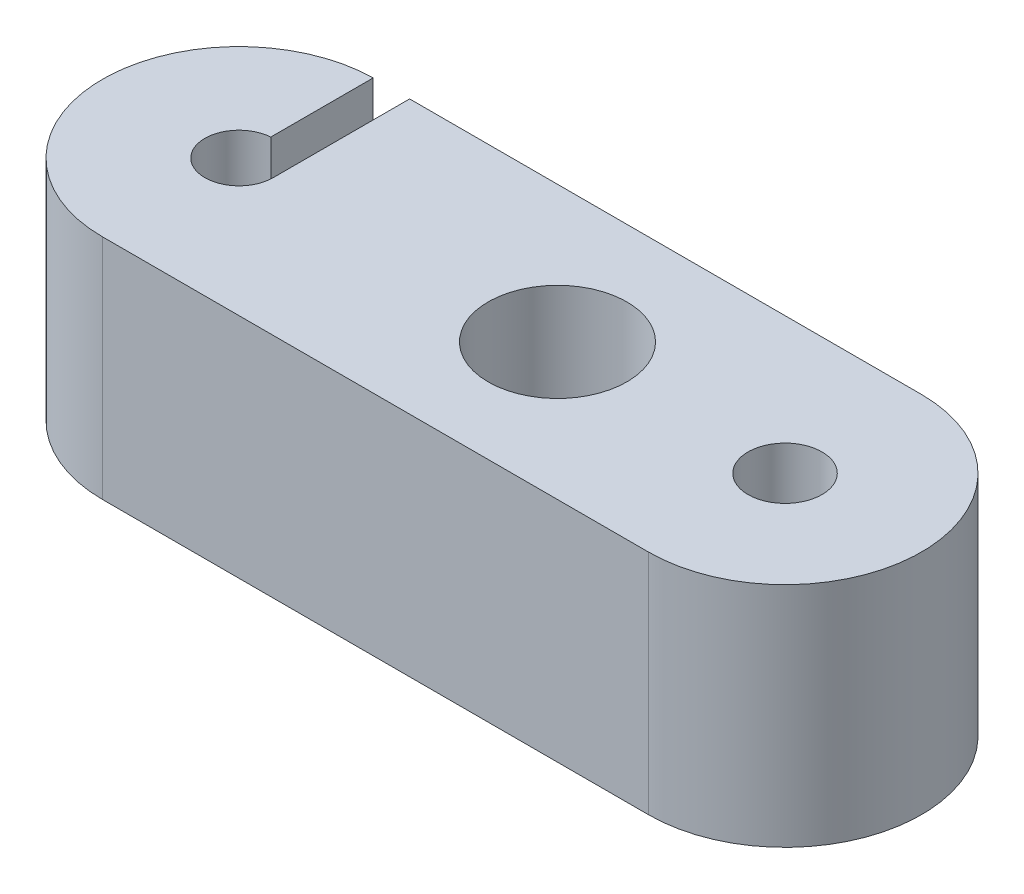
from build123d import *

# Parameters (mm, degrees)
SKETCH1_R           = 0.762
SKETCH1_R_2         = 0.4064
SKETCH1_R_3         = 0.375
BOSS_EXTRUDE1_DEPTH = 2.5
SKETCH2_W           = 0.4
SKETCH2_H           = 2.5
CUT_EXTRUDE1_DEPTH  = 6.361902647


with BuildPart() as part:
    # Sketch1 → Boss-Extrude1 (new body)
    with BuildSketch(Plane(origin=(0, 0, 0), x_dir=(1, 0, 0), z_dir=(0, 1, 0))):
        with BuildLine():
            Line((-3, 1.5), (3, 1.5))
            ThreePointArc((3, 1.5), (4.5, 0), (3, -1.5))
            Line((3, -1.5), (-3, -1.5))
            ThreePointArc((-3, -1.5), (-4.5, 0), (-3, 1.5))
        make_face()
        with Locations(Location((0.5, 0, 0), (0, 0, 270))):
            Circle(SKETCH1_R, mode=Mode.SUBTRACT)
        with Locations(Location((3, 0, 0), (0, 0, 270))):
            Circle(SKETCH1_R_2, mode=Mode.SUBTRACT)
        with Locations(Location((-3, 0, 0), (0, 0, 270))):
            Circle(SKETCH1_R_3, mode=Mode.SUBTRACT)
    extrude(amount=BOSS_EXTRUDE1_DEPTH)

    # Sketch2 → Cut-Extrude1 (cut, through all)
    with BuildSketch(Plane.XZ):
        with Locations((-2.825, -1.25)):
            Rectangle(SKETCH2_W, SKETCH2_H)
    extrude(amount=-CUT_EXTRUDE1_DEPTH, mode=Mode.SUBTRACT)


solid = part.part
